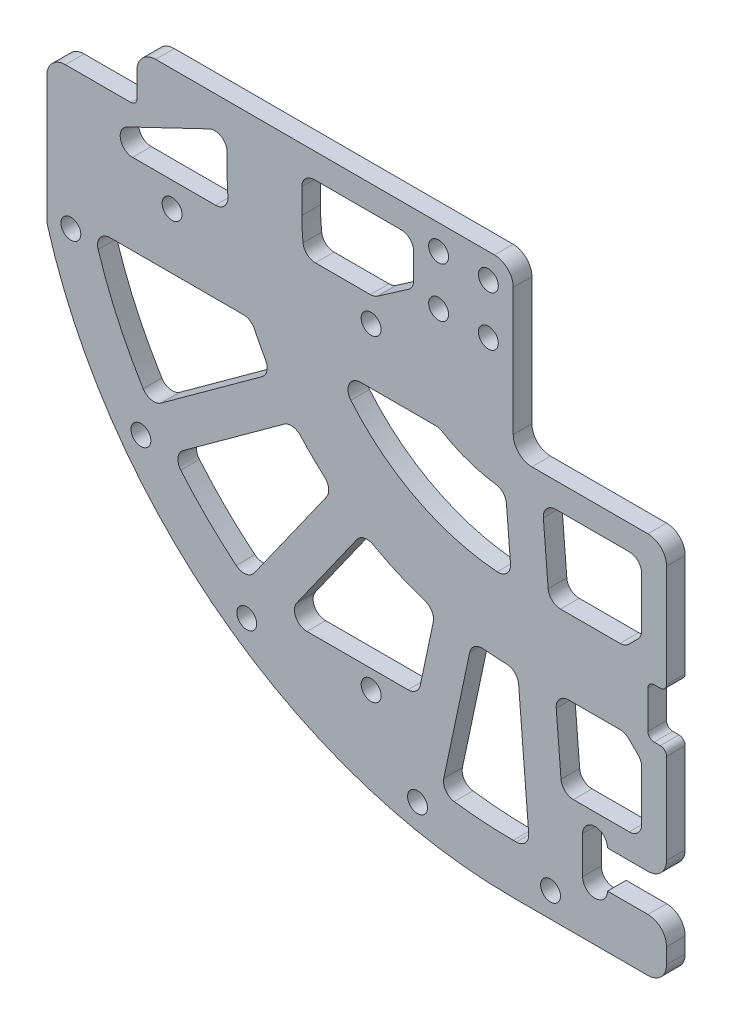
from build123d import *

# Parameters (mm, degrees)
EXTRUDE_1_DEPTH     = 3
SKETCH_3_R          = 2
CUT_EXTRUDE_1_DEPTH = 3
SKETCH_5_W          = 17.5
SKETCH_5_H          = 8
CUT_EXTRUDE_2_DEPTH = 3
FILLET_1_R          = 1
FILLET_2_R          = 1
CUT_EXTRUDE_3_DEPTH = 10
SKETCH_7_R          = 1.6
CUT_EXTRUDE_4_DEPTH = 10
SKETCH_8_R          = 1.6
CUT_EXTRUDE_5_DEPTH = 10
SKETCH_9_R          = 1.6
CUT_EXTRUDE_6_DEPTH = 3
SKETCH_10_R         = 1.6
CUT_EXTRUDE_7_DEPTH = 3
FILLET_3_R          = 3
FILLET_4_R          = 3
CUT_EXTRUDE_8_DEPTH = 11.6
CUT_EXTRUDE_9_DEPTH = 11.6
FILLET_5_R          = 2


with BuildPart() as part:
    # 草图2 → 凸台-拉伸1 (new body)
    with BuildSketch(Plane.XY):
        with BuildLine():
            Line((-177.154590294, 76.5), (-177.154590294, 66.5))
            ThreePointArc((-177.154590294, 66.5), (-154.308919227, 11.345671067), (-99.154590294, -11.5))
            Line((-99.154590294, -11.5), (-88, -11.5))
            Line((-88, -11.5), (-74.5, -11.5))
            Line((-74.5, -11.5), (-74.5, -3))
            Line((-74.5, -3), (-88, -3))
            Line((-88, -3), (-88, 3))
            Line((-88, 3), (-74.5, 3))
            Line((-74.5, 3), (-74.5, 21.5))
            Line((-74.5, 21.5), (-77.5, 21.5))
            Line((-77.5, 21.5), (-77.5, 29.5))
            Line((-77.5, 29.5), (-74.5, 29.5))
            Line((-74.5, 29.5), (-74.5, 50))
            Line((-74.5, 50), (-99.154590294, 50))
            Line((-99.154590294, 50), (-99.154590294, 76.5))
            Line((-99.154590294, 76.5), (-177.154590294, 76.5))
        make_face()
    extrude(amount=EXTRUDE_1_DEPTH)

    # 草图3 → 切除-拉伸1 (cut)
    with BuildSketch(Plane.XY.offset(3)):
        with Locations((-86, 3)):
            Circle(SKETCH_3_R)
        with Locations((-86, -3)):
            Circle(SKETCH_3_R)
    extrude(amount=-CUT_EXTRUDE_1_DEPTH, mode=Mode.SUBTRACT)

    # 草图5 → 切除-拉伸2 (cut)
    with BuildSketch(Plane.XY.offset(3)):
        with Locations((-168.404590294, 72.5)):
            Rectangle(SKETCH_5_W, SKETCH_5_H)
    extrude(amount=-CUT_EXTRUDE_2_DEPTH, mode=Mode.SUBTRACT)

    # 圆角1
    fillet_1_edges = [part.edges().sort_by_distance(p)[0] for p in [
        (-159.654590294, 68.5, 1.5),
    ]]
    fillet(fillet_1_edges, radius=FILLET_1_R)

    # 圆角2
    fillet_2_edges = [part.edges().sort_by_distance(p)[0] for p in [
        (-74.5, 29.5, 1.5),
        (-77.5, 29.5, 1.5),
        (-77.5, 21.5, 1.5),
        (-74.5, 21.5, 1.5),
    ]]
    fillet(fillet_2_edges, radius=FILLET_2_R)

    # 草图6 → 切除-拉伸3 (cut)
    with BuildSketch(Plane.XY.offset(3)):
        Polygon((-174.154590294, 69.502681713), (-174.154590294, 33.470652635), (-188.349025992, 74.64093898), align=None)
    extrude(amount=-CUT_EXTRUDE_3_DEPTH, mode=Mode.SUBTRACT)

    # 草图7 → 切除-拉伸4 (cut)
    with BuildSketch(Plane.XY.offset(3)):
        with Locations((-122, 6)):
            Circle(SKETCH_7_R)
        with Locations((-142, 6)):
            Circle(SKETCH_7_R)
    extrude(amount=-CUT_EXTRUDE_4_DEPTH, mode=Mode.SUBTRACT)

    # 草图8 → 切除-拉伸5 (cut)
    with BuildSketch(Plane.XY.offset(3)):
        with Locations((-170.287955794, 46.10283567)):
            Circle(SKETCH_8_R)
        with Locations((-159.021847878, 23.00389133)):
            Circle(SKETCH_8_R)
        with Locations((-93.154590294, -7.5)):
            Circle(SKETCH_8_R)
        with Locations((-114.540055415, -5.882922454)):
            Circle(SKETCH_8_R)
    extrude(amount=-CUT_EXTRUDE_5_DEPTH, mode=Mode.SUBTRACT)

    # 草图9 → 切除-拉伸6 (cut)
    with BuildSketch(Plane.XY.offset(3)):
        with Locations((-103.154590294, 72.5)):
            Circle(SKETCH_9_R)
        with Locations((-111.154590294, 72.5)):
            Circle(SKETCH_9_R)
        with Locations((-111.154590294, 64.5)):
            Circle(SKETCH_9_R)
        with Locations((-103.154590294, 64.5)):
            Circle(SKETCH_9_R)
    extrude(amount=-CUT_EXTRUDE_6_DEPTH, mode=Mode.SUBTRACT)

    # 草图10 → 切除-拉伸7 (cut)
    with BuildSketch(Plane.XY.offset(3)):
        with Locations((-122.010091835, 57)):
            Circle(SKETCH_10_R)
        with Locations((-154.010091835, 57)):
            Circle(SKETCH_10_R)
    extrude(amount=-CUT_EXTRUDE_7_DEPTH, mode=Mode.SUBTRACT)

    # 圆角3
    fillet_3_edges = [part.edges().sort_by_distance(p)[0] for p in [
        (-99.154590294, 50, 1.5),
    ]]
    fillet(fillet_3_edges, radius=FILLET_3_R)

    # 圆角4
    fillet_4_edges = [part.edges().sort_by_distance(p)[0] for p in [
        (-174.154590294, 68.5, 1.5),
        (-174.154590294, 45.075714714, 1.5),
        (-99.154590294, 76.5, 1.5),
        (-74.5, 50, 1.5),
        (-74.5, 3, 1.5),
        (-74.5, -3, 1.5),
        (-74.5, -11.5, 1.5),
        (-159.654590294, 76.5, 1.5),
    ]]
    fillet(fillet_4_edges, radius=FILLET_4_R)

    # 草图13 → 切除-拉伸8 (cut)
    with BuildSketch(Plane.XY.offset(3)):
        with BuildLine():
            Line((-166.665700491, 48), (-141.270501777, 48))
            ThreePointArc((-141.270501777, 48), (-139.774924791, 44.913234948), (-138.053500491, 41.946491381))
            Line((-138.053500491, 41.946491381), (-157.497103519, 27.819886884))
            ThreePointArc((-157.497103519, 27.819886884), (-162.885217731, 37.544739224), (-166.665700491, 48))
        make_face()
        with BuildLine():
            ThreePointArc((-134.526788978, 37.092389415), (-131.483826087, 33.776606028), (-128.131412478, 30.774046183))
            Line((-128.131412478, 30.774046183), (-142.021368274, 11.160688967))
            ThreePointArc((-142.021368274, 11.160688967), (-148.351253457, 16.703530912), (-153.970392005, 22.965784918))
            Line((-153.970392005, 22.965784918), (-134.526788978, 37.092389415))
        make_face()
        with BuildLine():
            Line((-127.680893946, 48), (-111.060471194, 48))
            ThreePointArc((-111.060471194, 48), (-105.946714568, 45.574727054), (-100.383436414, 44.53434642))
            Line((-100.383436414, 44.53434642), (-99.407755019, 32.500942548))
            ThreePointArc((-99.407755019, 32.500942548), (-115.498385615, 36.685903426), (-127.680893946, 48))
        make_face()
        with BuildLine():
            Line((-133.154590294, 72.5), (-133.154590294, 66.5))
            ThreePointArc((-133.154590294, 66.5), (-133.042454912, 63.740900214), (-132.706788434, 61))
            Line((-132.706788434, 61), (-121.498246805, 61))
            Line((-121.498246805, 61), (-115.154590294, 65.382793706))
            Line((-115.154590294, 65.382793706), (-115.154590294, 72.5))
            Line((-115.154590294, 72.5), (-133.154590294, 72.5))
        make_face()
        with BuildLine():
            ThreePointArc((-123.234931322, 27.306414096), (-117.609516434, 24.364317958), (-111.632610014, 22.224735756))
            Line((-111.632610014, 22.224735756), (-114.443614375, 9))
            Line((-114.443614375, 9), (-136.199324912, 9))
            Line((-136.199324912, 9), (-123.234931322, 27.306414096))
        make_face()
        with BuildLine():
            ThreePointArc((-105.763724409, 20.977265611), (-102.467762347, 20.619471549), (-99.154590294, 20.5))
            Line((-99.154590294, 20.5), (-98.434705623, 20.5))
            Line((-98.434705623, 20.5), (-96.488759677, -3.5))
            Line((-96.488759677, -3.5), (-99.154590294, -3.5))
            ThreePointArc((-99.154590294, -3.5), (-104.977776216, -3.257368827), (-110.760593955, -2.531157306))
            Line((-110.760593955, -2.531157306), (-105.763724409, 20.977265611))
        make_face()
    extrude(amount=-CUT_EXTRUDE_8_DEPTH, mode=Mode.SUBTRACT)

    # 草图14 → 切除-拉伸9 (cut)
    with BuildSketch(Plane.XY.offset(3)):
        with BuildLine():
            Line((-145.154590294, 72.5), (-145.154590294, 66.5))
            ThreePointArc((-145.154590294, 66.5), (-145.072019197, 63.745054808), (-144.824602337, 61))
            Line((-144.824602337, 61), (-169.154590294, 61))
            Line((-169.154590294, 61), (-145.154590294, 72.5))
        make_face()
        Polygon((-94.482583074, 46), (-93.387988479, 32.5), (-81.154590294, 32.5), (-78.5, 35.154590294), (-78.5, 46), align=None)
        Polygon((-92.415015506, 20.5), (-81.154590294, 20.5), (-78.5, 17.845409706), (-78.5, 7), (-91.320420912, 7), align=None)
    extrude(amount=-CUT_EXTRUDE_9_DEPTH, mode=Mode.SUBTRACT)

    # 圆角5
    fillet_5_edges = [part.edges().sort_by_distance(p)[0] for p in [
        (-111.632610014, 22.224735756, 1.5),
        (-114.443614375, 9, 1.5),
        (-136.199324912, 9, 1.5),
        (-123.234931322, 27.306414096, 1.5),
        (-115.154590294, 72.5, 1.5),
        (-115.154590294, 65.382793706, 1.5),
        (-121.498246805, 61, 1.5),
        (-132.706788434, 61, 1.5),
        (-133.154590294, 72.5, 1.5),
        (-128.131412478, 30.774046183, 1.5),
        (-142.021368274, 11.160688967, 1.5),
        (-153.970392005, 22.965784918, 1.5),
        (-134.526788978, 37.092389415, 1.5),
        (-138.053500491, 41.946491381, 1.5),
        (-157.497103519, 27.819886884, 1.5),
        (-166.665700491, 48, 1.5),
        (-98.434705623, 20.5, 1.5),
        (-96.488759677, -3.5, 1.5),
        (-110.760593955, -2.531157306, 1.5),
        (-105.763724409, 20.977265611, 1.5),
        (-111.060471194, 48, 1.5),
        (-100.383436414, 44.53434642, 1.5),
        (-99.407755019, 32.500942548, 1.5),
        (-127.680893946, 48, 1.5),
        (-81.154590294, 20.5, 1.5),
        (-78.5, 17.845409706, 1.5),
        (-78.5, 7, 1.5),
        (-91.320420912, 7, 1.5),
        (-92.415015506, 20.5, 1.5),
        (-78.5, 35.154590294, 1.5),
        (-81.154590294, 32.5, 1.5),
        (-93.387988479, 32.5, 1.5),
        (-94.482583074, 46, 1.5),
        (-78.5, 46, 1.5),
        (-144.824602337, 61, 1.5),
        (-169.154590294, 61, 1.5),
        (-145.154590294, 72.5, 1.5),
        (-141.270501777, 48, 1.5),
    ]]
    fillet(fillet_5_edges, radius=FILLET_5_R)


solid = part.part
